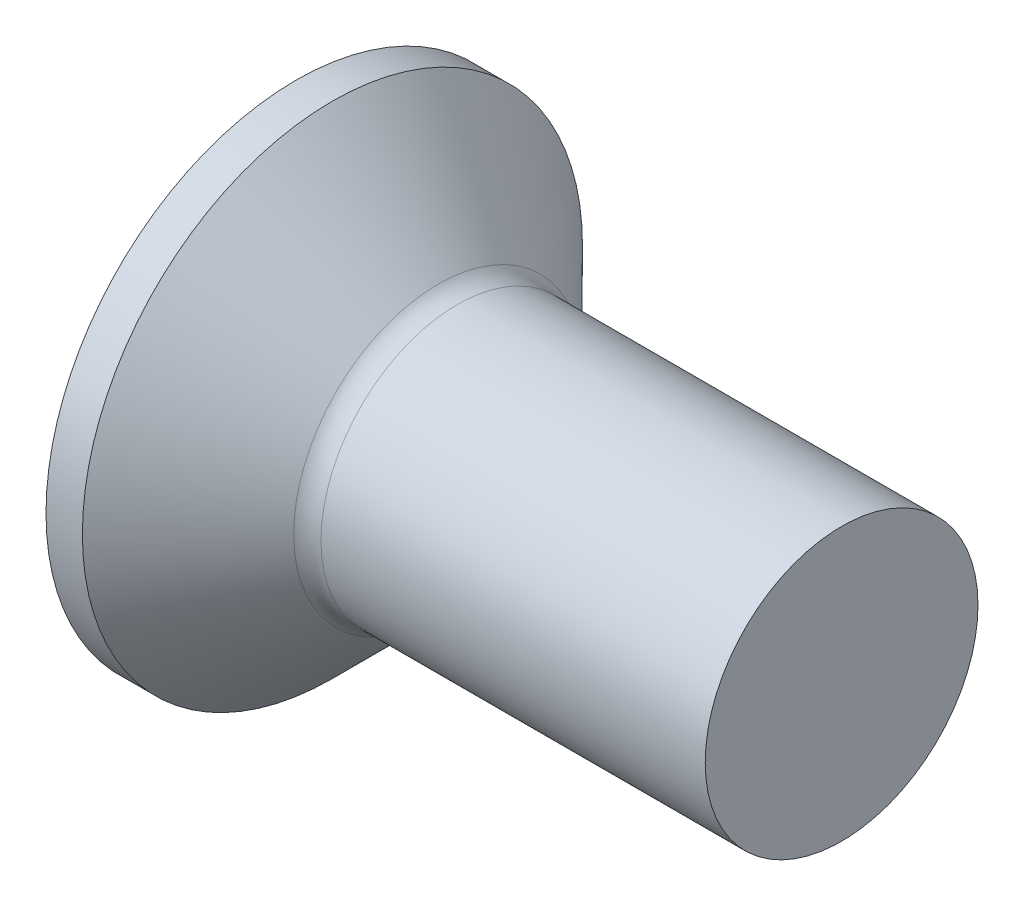
from build123d import *

# Parameters (mm, degrees)
FILLET1_R    = 0.3
RECPAT_COUNT = 2
RECPAT_ANGLE = 90


with BuildPart() as part:
    # BodySke → BaseBody (revolve)
    with BuildSketch(Plane.XY, mode=Mode.PRIVATE) as basebody_sk:
        Polygon((0, 0), (0, 2.75), (0.4, 2.75), (1.65, 1.5), (6, 1.5), (6, 0), align=None)
    revolve(basebody_sk.sketch.rotate(Axis((0, 0, 0), (1, 0, 0)), 90), axis=Axis((0, 0, 0), (1, 0, 0)))

    # Fillet1
    fillet1_edges = [part.edges().sort_by_distance(p)[0] for p in [
        (1.65, 0, -1.5),
    ]]
    fillet(fillet1_edges, radius=FILLET1_R)

    # RecSkeTop → Recess section 0
    with BuildSketch(Plane.ZY):
        with BuildLine():
            Line((-0.3465, 1.575), (0.3465, 1.575))
            Line((0.3465, 1.575), (0.3465, -1.575))
            Line((0.3465, -1.575), (-0.3465, -1.575))
            Line((-0.3465, -1.575), (-0.3465, 1.575))
        make_face()
    # RecSkeBot → Recess section 1
    with BuildSketch(Plane(origin=(1.86, 0, 0), x_dir=(0, 0, -1), z_dir=(1, 0, 0))):
        with BuildLine():
            Line((0.3465, 0.647638364), (-0.3465, 0.647638364))
            Line((-0.3465, 0.647638364), (-0.3465, -0.647638364))
            Line((-0.3465, -0.647638364), (0.3465, -0.647638364))
            Line((0.3465, -0.647638364), (0.3465, 0.647638364))
        make_face()
    recess = loft(mode=Mode.SUBTRACT)

    # RecPat: Recess ×2 about axis
    recpat_axis = Axis((0, 0, 0), (1, 0, 0))
    for i in range(1, RECPAT_COUNT):
        add(recess.rotate(recpat_axis, i * RECPAT_ANGLE / (RECPAT_COUNT - 1)), mode=Mode.SUBTRACT)

    # RecCorSke → RecessCore (revolve, cut)
    with BuildSketch(Plane.XY, mode=Mode.PRIVATE) as recesscore_sk:
        Polygon((0, 0), (0, 0.7623), (1.86, 0.63223613), (2.065425971, 0), align=None)
    revolve(recesscore_sk.sketch.rotate(Axis((0, 0, 0), (1, 0, 0)), 90), axis=Axis((0, 0, 0), (1, 0, 0)), mode=Mode.SUBTRACT)


solid = part.part
